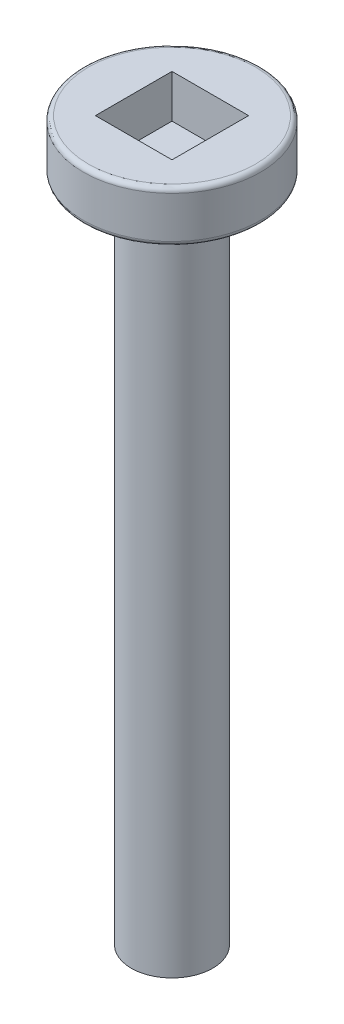
from build123d import *

# Parameters (mm, degrees)
SKETCH1_R           = 4.699
BOSS_EXTRUDE1_DEPTH = 2.7178
SKETCH2_R           = 2.159
BOSS_EXTRUDE2_DEPTH = 38.1
SKETCH3_W           = 4.064
SKETCH3_H           = 4.064
CUT_EXTRUDE1_DEPTH  = 2.286
FILLET2_R           = 0.254


with BuildPart() as part:
    # Sketch1 → Boss-Extrude1 (new body)
    with BuildSketch(Plane(origin=(0, 0, 0), x_dir=(1, 0, 0), z_dir=(0, 1, 0))):
        with Locations(Location((0, 0, 0), (0, 0, 270))):
            Circle(SKETCH1_R)
    extrude(amount=-BOSS_EXTRUDE1_DEPTH)

    # Sketch2 → Boss-Extrude2 (add)
    with BuildSketch(Plane(origin=(0, 0, 0), x_dir=(1, 0, 0), z_dir=(0, 1, 0))):
        with Locations(Location((0, 0, 0), (0, 0, 270))):
            Circle(SKETCH2_R)
    extrude(amount=-BOSS_EXTRUDE2_DEPTH)

    # Sketch3 → Cut-Extrude1 (cut)
    with BuildSketch(Plane(origin=(0, 0, 0), x_dir=(1, 0, 0), z_dir=(0, 1, 0))):
        Rectangle(SKETCH3_W, SKETCH3_H)
    extrude(amount=-CUT_EXTRUDE1_DEPTH, mode=Mode.SUBTRACT)

    # Fillet2
    fillet2_edges = [part.edges().sort_by_distance(p)[0] for p in [
        (0, 0, -4.699),
        (0, -2.7178, -4.699),
    ]]
    fillet(fillet2_edges, radius=FILLET2_R)


solid = part.part
